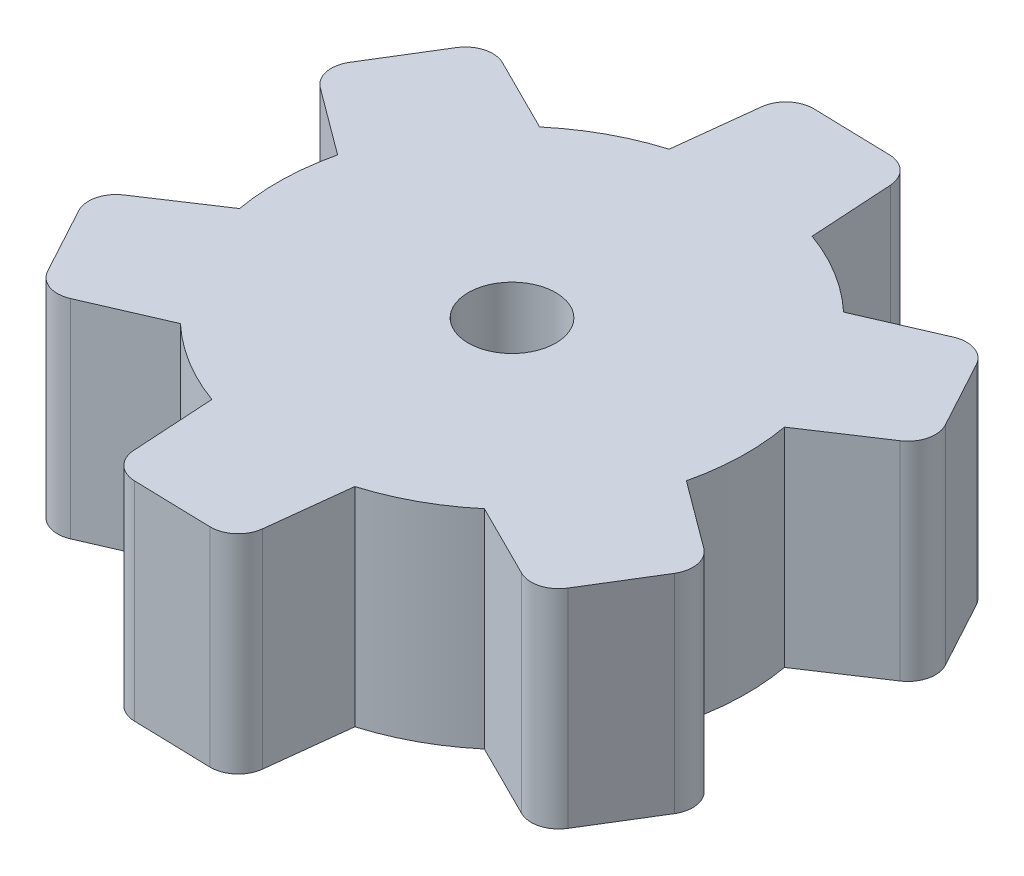
from build123d import *

# Parameters (mm, degrees)
SKETCH1_R           = 8.509
BOSS_EXTRUDE1_DEPTH = 7.55
SKETCH2_R           = 1.5875
CUT_EXTRUDE1_DEPTH  = 15.205937561
BOSS_EXTRUDE2_DEPTH = 7.55
CIRPATTERN1_COUNT   = 6


with BuildPart() as part:
    # Sketch1 → Boss-Extrude1 (new body)
    with BuildSketch(Plane(origin=(0, 0, 0), x_dir=(1, 0, 0), z_dir=(0, 1, 0))):
        with Locations(Location((0, 0, 0), (0, 0, 270))):
            Circle(SKETCH1_R)
    extrude(amount=BOSS_EXTRUDE1_DEPTH)

    # Sketch2 → Cut-Extrude1 (cut, through all)
    with BuildSketch(Plane(origin=(0, 7.55, 0), x_dir=(1, 0, 0), z_dir=(0, 1, 0))):
        with Locations(Location((0, 0, 0), (0, 0, 270))):
            Circle(SKETCH2_R)
    extrude(amount=-CUT_EXTRUDE1_DEPTH, mode=Mode.SUBTRACT)

    # Sketch3 → Boss-Extrude2 (add, through all)
    with BuildSketch(Plane(origin=(0, 7.55, 0), x_dir=(1, 0, 0), z_dir=(0, 1, 0))):
        with BuildLine():
            Line((-1.082882935, 12.042261501), (1.725110007, 11.967150578))
            ThreePointArc((1.725110007, 11.967150578), (2.393433601, 11.686456973), (2.69653959, 11.027995064))
            Line((2.69653959, 11.027995064), (2.879609723, 8.006930051))
            ThreePointArc((2.879609723, 8.006930051), (0.227525612, 8.505957506), (-2.447443894, 8.149423255))
            Line((-2.447443894, 8.149423255), (-2.103130346, 11.156381297))
            ThreePointArc((-2.103130346, 11.156381297), (-1.765256626, 11.797697659), (-1.082882935, 12.042261501))
        make_face()
    boss_extrude2 = extrude(amount=-BOSS_EXTRUDE2_DEPTH)

    # CirPattern1: Boss-Extrude2 ×6 about axis
    cirpattern1_axis = Axis((0, 0, 0), (0, 1, 0))
    for i in range(1, CIRPATTERN1_COUNT):
        add(boss_extrude2.rotate(cirpattern1_axis, i * 360 / CIRPATTERN1_COUNT))


solid = part.part
